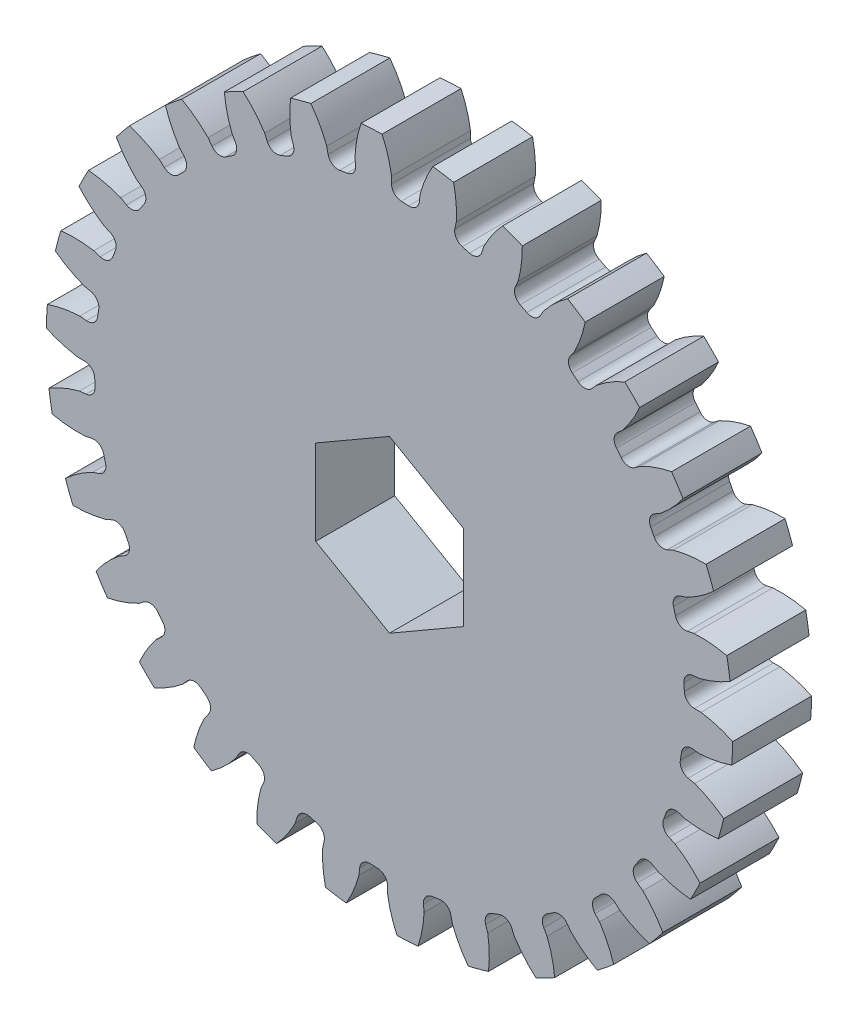
from build123d import *

# Parameters (mm, degrees)
SKETCH1_R                = 25.4
BOSS_EXTRUDE1_DEPTH      = 5.842
CUT_EXTRUDE1_DEPTH       = 37.392979598
FILLET1_R                = 0.7480935
CIRPATTERN1_COUNT        = 30
FILLET1_OF_CIRPATTERN1_R = 0.7480935
CUT_EXTRUDE2_DEPTH       = 37.384587251
CUT_EXTRUDE2_DEPTH_BACK  = 37.384587251


with BuildPart() as part:
    # Sketch1 → Boss-Extrude1 (new body)
    with BuildSketch(Plane.XY):
        Circle(SKETCH1_R)
    extrude(amount=-BOSS_EXTRUDE1_DEPTH)

    # Sketch4 → Cut-Extrude1 (cut, through all)
    with BuildSketch(Plane.XY):
        with BuildLine():
            Line((0.149938355, 23.053528098), (0.149938355, 21.827610027))
            ThreePointArc((0.149938355, 21.827610027), (1.142398464, 21.798210173), (2.132494875, 21.723708399))
            Line((2.132494875, 21.723708399), (2.260638506, 22.942910731))
            add(Edge.make_bspline(
                [(5.26956221, 27.605137666), (2.968780904, 25.645058989), (2.260638506, 22.942910731)],
                knots=[0, 0, 0, 1, 1, 1], degree=2))
            ThreePointArc((5.26956221, 27.605137666), (1.470831824, 28.065077323), (-2.35516552, 28.00473365))
            add(Edge.make_bspline(
                [(-2.35516552, 28.00473365), (-0.271872684, 25.814894844), (0.149938355, 23.053528098)],
                knots=[0, 0, 0, 1, 1, 1], degree=2))
        make_face()
    cut_extrude1 = extrude(amount=-CUT_EXTRUDE1_DEPTH, mode=Mode.SUBTRACT)

    # Fillet1
    fillet1_edges = [part.edges().sort_by_distance(p)[0] for p in [
        (2.132494875, 21.723708399, -2.921),
        (0.149938355, 21.827610027, -2.921),
    ]]
    fillet(fillet1_edges, radius=FILLET1_R)

    # CirPattern1: Cut-Extrude1 ×30 about axis
    cirpattern1_axis = Axis((0, 0, -5.842), (0, 0, 1))
    for i in range(1, CIRPATTERN1_COUNT):
        add(cut_extrude1.rotate(cirpattern1_axis, i * 360 / CIRPATTERN1_COUNT), mode=Mode.SUBTRACT)

    # Fillet1 of CirPattern1
    fillet1_of_cirpattern1_edges = [part.edges().sort_by_distance(p)[0] for p in [
        (-2.430718198, 21.692363865, -2.921),
        (-4.391553465, 21.381798315, -2.921),
        (-6.887697223, 20.712958938, -2.921),
        (-8.741113326, 20.001499415, -2.921),
        (-11.043650828, 18.828298314, -2.921),
        (-12.708644589, 17.747039013, -2.921),
        (-14.716943898, 16.120750706, -2.921),
        (-16.120747102, 14.716947846, -2.921),
        (-17.747035901, 12.708648935, -2.921),
        (-18.82829561, 11.043655438, -2.921),
        (-20.001497274, 8.741118224, -2.921),
        (-20.712957252, 6.887702295, -2.921),
        (-21.38179724, 4.391558701, -2.921),
        (-21.69236327, 2.43072351, -2.921),
        (-21.827610064, -0.14993301, -2.921),
        (-21.723708922, -2.132489556, -2.921),
        (-21.319451588, -4.684871929, -2.921),
        (-20.805624252, -6.602502595, -2.921),
        (-19.879530776, -9.015059464, -2.921),
        (-18.978233965, -10.783954589, -2.921),
        (-17.570779076, -12.951245642, -2.921),
        (-16.321403787, -14.49409602, -2.921),
        (-14.494100017, -16.321400238, -2.921),
        (-12.951249944, -17.570775905, -2.921),
        (-10.783959236, -18.978231324, -2.921),
        (-9.015064332, -19.879528568, -2.921),
        (-6.60250769, -20.805622635, -2.921),
        (-4.68487715, -21.319450441, -2.921),
        (-2.132494875, -21.723708399, -2.921),
        (-0.149938355, -21.827610027, -2.921),
        (2.430718198, -21.692363865, -2.921),
        (4.391553465, -21.381798315, -2.921),
        (6.887697223, -20.712958938, -2.921),
        (8.741113326, -20.001499415, -2.921),
        (11.043650828, -18.828298314, -2.921),
        (12.708644589, -17.747039013, -2.921),
        (14.716943898, -16.120750706, -2.921),
        (16.120747102, -14.716947846, -2.921),
        (17.747035901, -12.708648935, -2.921),
        (18.82829561, -11.043655438, -2.921),
        (20.001497274, -8.741118224, -2.921),
        (20.712957252, -6.887702295, -2.921),
        (21.38179724, -4.391558701, -2.921),
        (21.69236327, -2.43072351, -2.921),
        (21.827610064, 0.14993301, -2.921),
        (21.723708922, 2.132489556, -2.921),
        (21.319451588, 4.684871929, -2.921),
        (20.805624252, 6.602502595, -2.921),
        (19.879530776, 9.015059464, -2.921),
        (18.978233965, 10.783954589, -2.921),
        (17.570779076, 12.951245642, -2.921),
        (16.321403787, 14.49409602, -2.921),
        (14.494100017, 16.321400238, -2.921),
        (12.951249944, 17.570775905, -2.921),
        (10.783959236, 18.978231324, -2.921),
        (9.015064332, 19.879528568, -2.921),
        (6.60250769, 20.805622635, -2.921),
        (4.68487715, 21.319450441, -2.921),
    ]]
    fillet(fillet1_of_cirpattern1_edges, radius=FILLET1_OF_CIRPATTERN1_R)

    # Sketch5 → Cut-Extrude2 (cut, two sides: drawn at the far end of the back side and taken through both)
    with BuildSketch(Plane.XY.offset(-CUT_EXTRUDE2_DEPTH_BACK)):
        Polygon((0, 6.30581964), (-5.461, 3.15290982), (-5.461, -3.15290982), (0, -6.30581964), (5.461, -3.15290982), (5.461, 3.15290982), align=None)
    extrude(amount=CUT_EXTRUDE2_DEPTH + CUT_EXTRUDE2_DEPTH_BACK, mode=Mode.SUBTRACT)


solid = part.part
